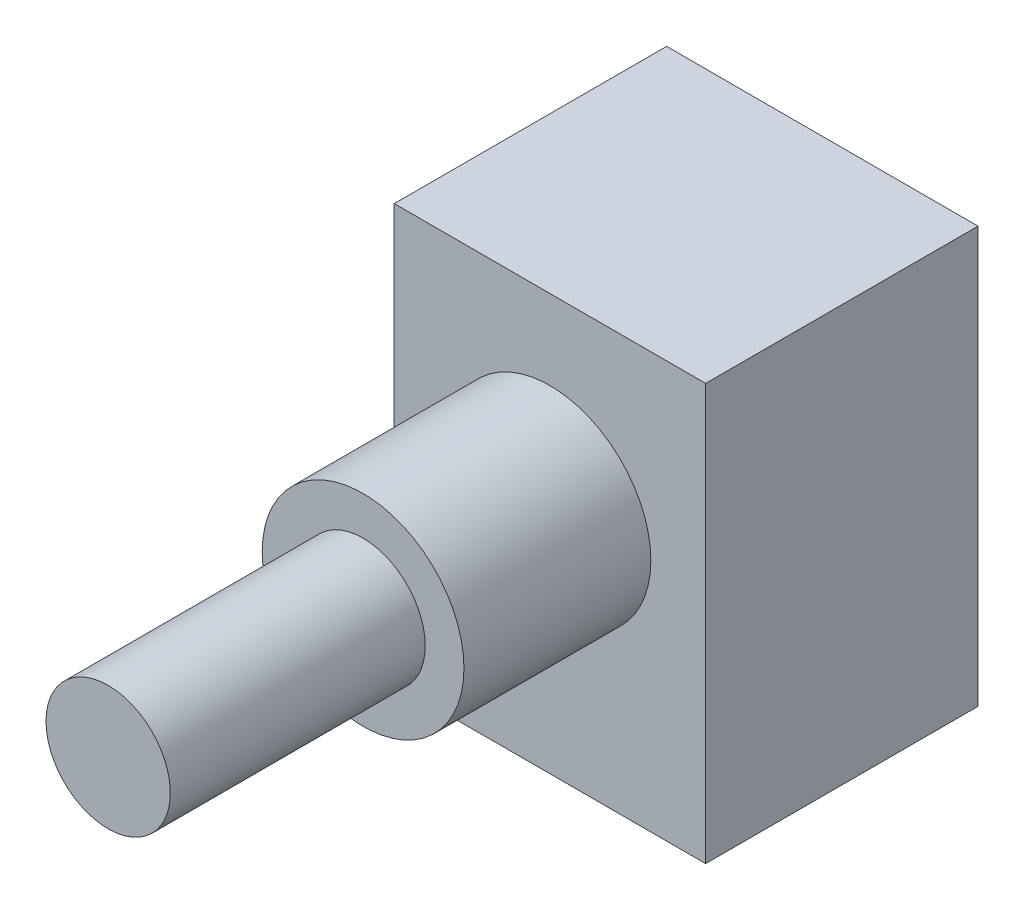
from build123d import *

# Parameters (mm, degrees)
SKETCH2_W           = 15.88
SKETCH2_H           = 21.21
BOSS_EXTRUDE1_DEPTH = 13.89
SKETCH3_R           = 5.145
BOSS_EXTRUDE2_DEPTH = 9.53
SKETCH4_R           = 3.17
BOSS_EXTRUDE3_DEPTH = 13


with BuildPart() as part:
    # Sketch2 → Boss-Extrude1 (new body)
    with BuildSketch(Plane.XY):
        with Locations((7.94, 10.605)):
            Rectangle(SKETCH2_W, SKETCH2_H)
    extrude(amount=BOSS_EXTRUDE1_DEPTH)

    # Sketch3 → Boss-Extrude2 (add)
    with BuildSketch(Plane.XY.offset(13.89)):
        with Locations((7.94, 12)):
            Circle(SKETCH3_R)
    extrude(amount=BOSS_EXTRUDE2_DEPTH)

    # Sketch4 → Boss-Extrude3 (add)
    with BuildSketch(Plane.XY.offset(23.42)):
        with Locations(Location((7.94, 12, 0), (0, 0, 180))):
            Circle(SKETCH4_R)
    extrude(amount=BOSS_EXTRUDE3_DEPTH)


solid = part.part
